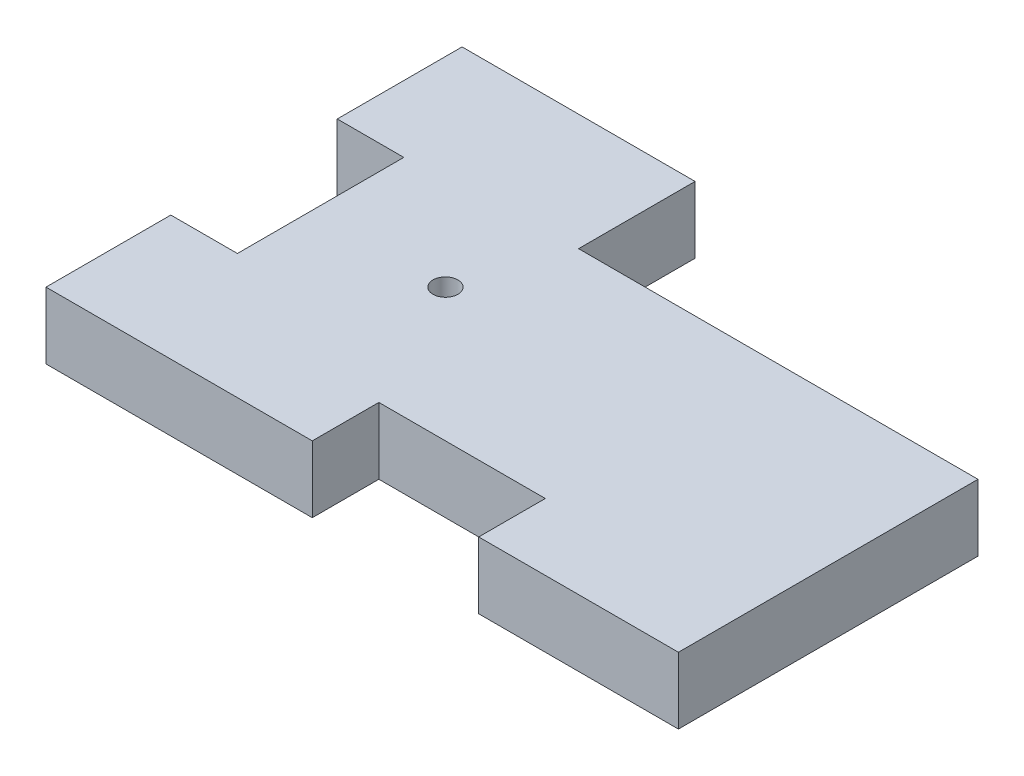
from build123d import *

# Parameters (mm, degrees)
SKETCH1_W           = 38
SKETCH1_H           = 25
BOSS_EXTRUDE1_DEPTH = 4
SKETCH2_W           = 24
SKETCH2_H           = 7
CUT_EXTRUDE1_DEPTH  = 46.661800227
SKETCH3_W           = 4
SKETCH3_H           = 10
CUT_EXTRUDE2_DEPTH  = 46.661800227
SKETCH4_W           = 10
SKETCH4_H           = 4
CUT_EXTRUDE3_DEPTH  = 46.661800227
SKETCH5_R           = 0.75
CUT_EXTRUDE4_DEPTH  = 46.661800227


with BuildPart() as part:
    # Sketch1 → Boss-Extrude1 (new body)
    with BuildSketch(Plane(origin=(0, 0, 0), x_dir=(1, 0, 0), z_dir=(0, 1, 0))):
        with Locations((19, -12.5)):
            Rectangle(SKETCH1_W, SKETCH1_H)
    extrude(amount=BOSS_EXTRUDE1_DEPTH)

    # Sketch2 → Cut-Extrude1 (cut, through all)
    with BuildSketch(Plane(origin=(0, 4, 0), x_dir=(1, 0, 0), z_dir=(0, 1, 0))):
        with Locations((26, -3.5)):
            Rectangle(SKETCH2_W, SKETCH2_H)
    extrude(amount=-CUT_EXTRUDE1_DEPTH, mode=Mode.SUBTRACT)

    # Sketch3 → Cut-Extrude2 (cut, through all)
    with BuildSketch(Plane.XZ):
        with Locations((2, 12.5)):
            Rectangle(SKETCH3_W, SKETCH3_H)
    extrude(amount=-CUT_EXTRUDE2_DEPTH, mode=Mode.SUBTRACT)

    # Sketch4 → Cut-Extrude3 (cut, through all)
    with BuildSketch(Plane(origin=(0, 0, 0), x_dir=(-1, 0, 0), z_dir=(0, -1, 0))):
        with Locations((-21, -23)):
            Rectangle(SKETCH4_W, SKETCH4_H)
    extrude(amount=-CUT_EXTRUDE3_DEPTH, mode=Mode.SUBTRACT)

    # Sketch5 → Cut-Extrude4 (cut, through all)
    with BuildSketch(Plane(origin=(0, 4, 0), x_dir=(1, 0, 0), z_dir=(0, 1, 0))):
        with Locations(Location((12, -13, 0), (0, 0, 270))):
            Circle(SKETCH5_R)
    extrude(amount=-CUT_EXTRUDE4_DEPTH, mode=Mode.SUBTRACT)


solid = part.part
